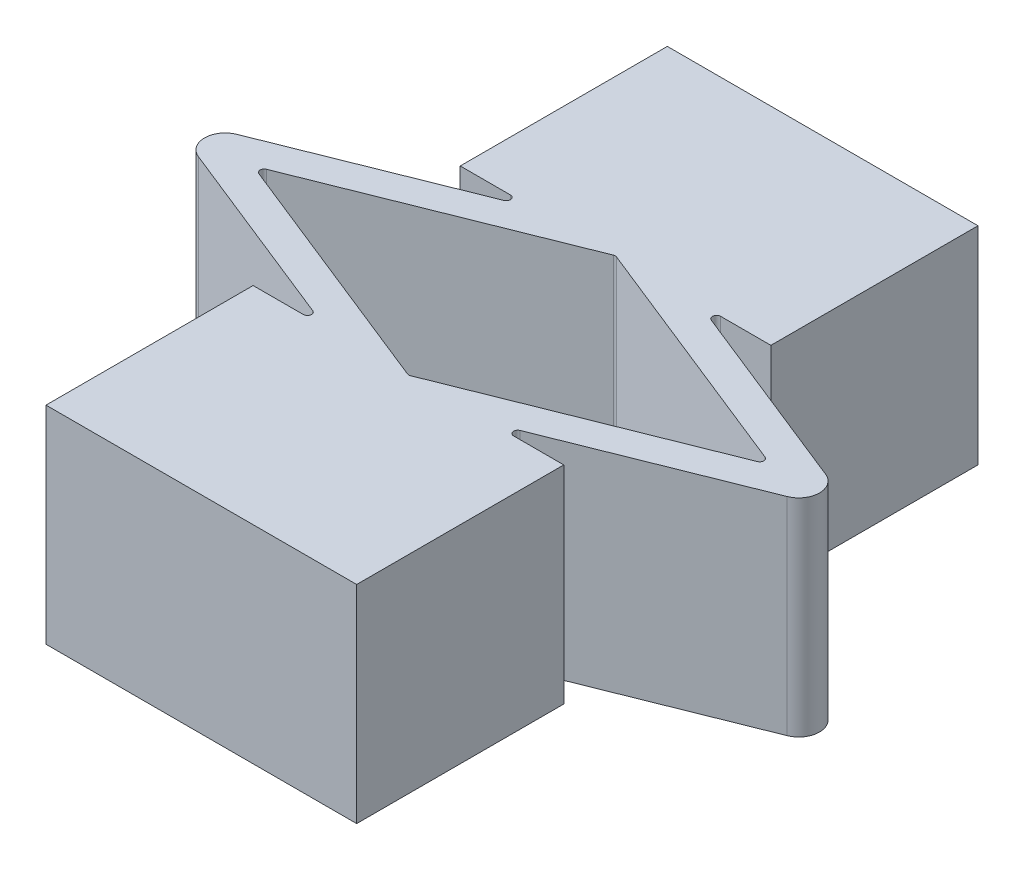
from build123d import *

# Parameters (mm, degrees)
SKETCH1_W             = 15
SKETCH1_H             = 10
BOSS_EXTRUDE2_DEPTH   = 10
BOSS_EXTRUDE2_2_DEPTH = 10
BOSS_EXTRUDE3_DEPTH   = 10
FILLET1_R             = 0.2
FILLET2_R             = 1


with BuildPart() as part:
    # Sketch1 → Boss-Extrude2 (new body)
    with BuildSketch(Plane(origin=(0, 0, 0), x_dir=(1, 0, 0), z_dir=(0, 1, 0))):
        with Locations((0, 20)):
            Rectangle(SKETCH1_W, SKETCH1_H)
    extrude(amount=BOSS_EXTRUDE2_DEPTH)



with BuildPart() as body_2:
    # Sketch1 → Boss-Extrude2 2 (new body)
    with BuildSketch(Plane(origin=(0, 0, 0), x_dir=(1, 0, 0), z_dir=(0, 1, 0))):
        Rectangle(SKETCH1_W, SKETCH1_H)
    extrude(amount=BOSS_EXTRUDE2_2_DEPTH)


with BuildPart() as part_1:
    add(part.part)

    add(body_2.part)  # Boss-Extrude3 merges body 2
    # Sketch1<4> → Boss-Extrude3 (add)
    with BuildSketch(Plane(origin=(0, 0, 0), x_dir=(1, 0, 0), z_dir=(0, 1, 0))):
        Polygon((-12.5, 10), (0, 15), (-4.038873605, 15), (-16.538873605, 10), (-4.038873605, 5), (0, 5), align=None)
    boss_extrude3 = extrude(amount=BOSS_EXTRUDE3_DEPTH)

    # Mirror1: Boss-Extrude3 across plane
    add(boss_extrude3.mirror(Plane.ZY))

    # Fillet1
    fillet1_edges = [part_1.edges().sort_by_distance(p)[0] for p in [
        (4.038873605, 5, -5),
        (4.038873605, 5, -15),
        (-4.038873605, 5, -15),
        (-4.038873605, 5, -5),
        (0, 5, -5),
        (12.5, 5, -10),
        (0, 5, -15),
        (-12.5, 5, -10),
    ]]
    fillet(fillet1_edges, radius=FILLET1_R)

    # Fillet2
    fillet2_edges = [part_1.edges().sort_by_distance(p)[0] for p in [
        (16.538873605, 5, -10),
        (-16.538873605, 5, -10),
    ]]
    fillet(fillet2_edges, radius=FILLET2_R)


solid = part_1.part
